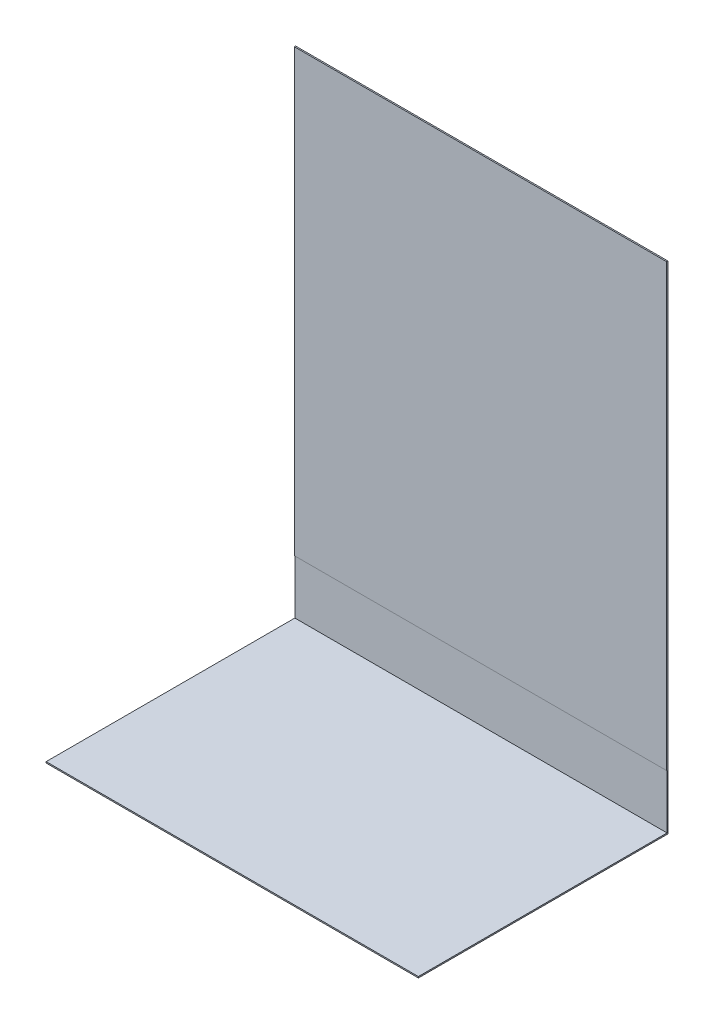
from build123d import *

# Parameters (mm, degrees)
SKETCH1_W           = 1828.8
SKETCH1_H           = 2438.4
BOSS_EXTRUDE1_DEPTH = 6.35
SKETCH2_W           = 1828.8
SKETCH2_H           = 6.35
BOSS_EXTRUDE2_DEPTH = 1219.2
SKETCH3_W           = 1828.8
SKETCH3_H           = 266.7
CUT_EXTRUDE1_DEPTH  = 2.54


with BuildPart() as part:
    # Sketch1 → Boss-Extrude1 (new body)
    with BuildSketch(Plane.XY):
        Rectangle(SKETCH1_W, SKETCH1_H)
    extrude(amount=BOSS_EXTRUDE1_DEPTH)

    # Sketch2 → Boss-Extrude2 (add)
    with BuildSketch(Plane.XY.offset(6.35)):
        with Locations((0, -1216.025)):
            Rectangle(SKETCH2_W, SKETCH2_H)
    extrude(amount=BOSS_EXTRUDE2_DEPTH)

    # Sketch3 → Cut-Extrude1 (cut)
    with BuildSketch(Plane.XY.offset(6.35)):
        with Locations((0, -1079.5)):
            Rectangle(SKETCH3_W, SKETCH3_H)
    extrude(amount=-CUT_EXTRUDE1_DEPTH, mode=Mode.SUBTRACT)


solid = part.part
